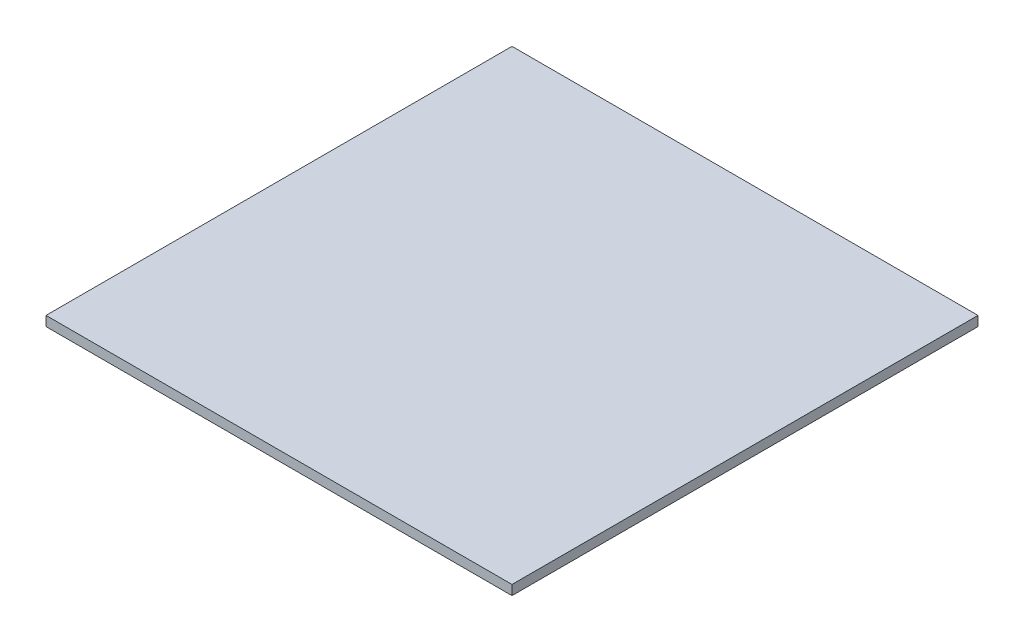
from build123d import *

# Parameters (mm, degrees)
SKETCH1_W           = 240
SKETCH1_H           = 240
BOSS_EXTRUDE1_DEPTH = 5


with BuildPart() as part:
    # Sketch1 → Boss-Extrude1 (new body)
    with BuildSketch(Plane(origin=(0, 0, 0), x_dir=(1, 0, 0), z_dir=(0, 1, 0))):
        with Locations((120, -120)):
            Rectangle(SKETCH1_W, SKETCH1_H)
    extrude(amount=BOSS_EXTRUDE1_DEPTH)


solid = part.part
